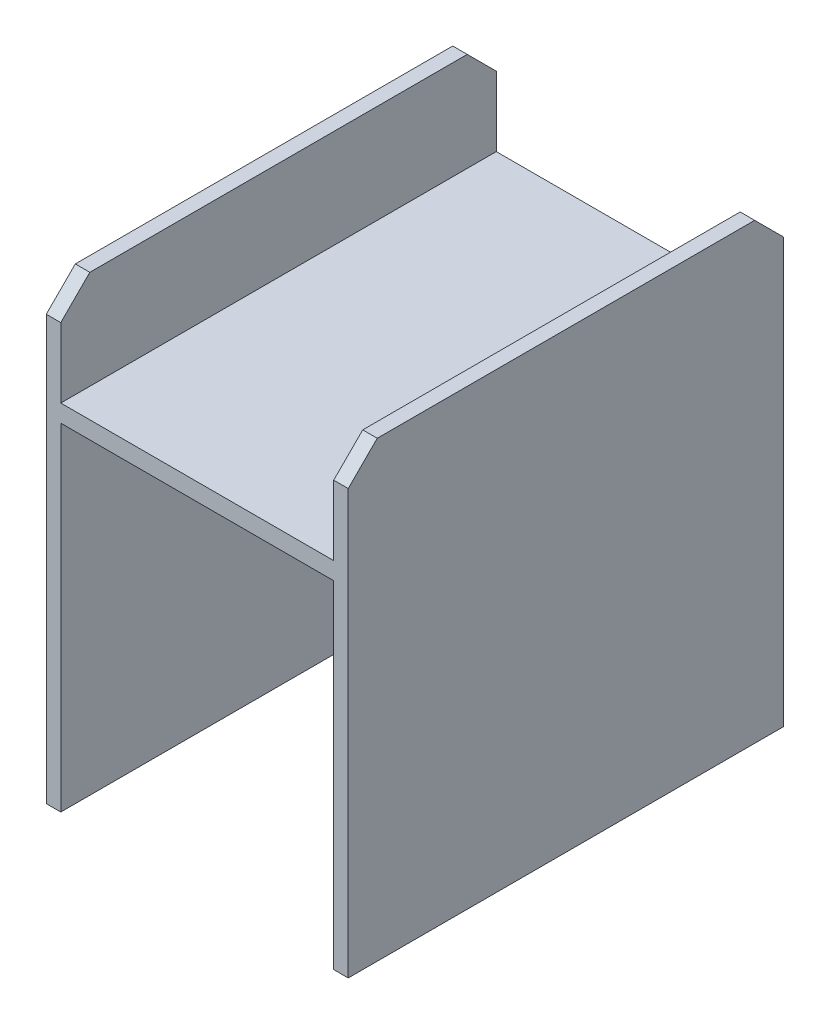
from build123d import *

# Parameters (mm, degrees)
SKETCH1_W                = 52
SKETCH1_H                = 75
BOSS_EXTRUDE1_DEPTH      = 3
BOSS_EXTRUDE2_DEPTH      = 38
BOSS_EXTRUDE2_DEPTH_BACK = 40
SKETCH2_W                = 2.5
SKETCH2_H                = 75
SKETCH5_W                = 75
SKETCH5_H                = 3
BOSS_EXTRUDE5_DEPTH      = 47
CUT_EXTRUDE1_DEPTH       = 92.643201899
CUT_EXTRUDE1_DEPTH_BACK  = 92.643201899
SKETCH6_W                = 47
SKETCH6_H                = 3
CHAMFER1_SIZE            = 5


with BuildPart() as part:
    # Sketch1 → Boss-Extrude1 (new body)
    with BuildSketch(Plane(origin=(0, 0, 0), x_dir=(1, 0, 0), z_dir=(0, 1, 0))):
        with Locations((-7.052631579, -5.043859649)):
            Rectangle(SKETCH1_W, SKETCH1_H)
    extrude(amount=BOSS_EXTRUDE1_DEPTH)

    # Sketch2 → Boss-Extrude2 (add, two sides: drawn at the far end of the back side and taken through both)
    with BuildSketch(Plane(origin=(0, 3, 0), x_dir=(1, 0, 0), z_dir=(0, 1, 0)).offset(-BOSS_EXTRUDE2_DEPTH_BACK)):
        with Locations((-31.802631579, -5.043859649)):
            Rectangle(SKETCH2_W, SKETCH2_H)
        with Locations((17.697368421, -5.043859649)):
            Rectangle(SKETCH2_W, SKETCH2_H)
    extrude(amount=BOSS_EXTRUDE2_DEPTH + BOSS_EXTRUDE2_DEPTH_BACK)

    # Sketch5 → Boss-Extrude5 (add)
    with BuildSketch(Plane(origin=(-30.552631579, 0, 0), x_dir=(0, 0, -1), z_dir=(1, 0, 0))):
        with Locations((-5.043859649, 22.5)):
            Rectangle(SKETCH5_W, SKETCH5_H)
    extrude(amount=BOSS_EXTRUDE5_DEPTH)

    # Sketch6 → Cut-Extrude1 (cut, two sides: drawn at the far end of the back side and taken through both)
    with BuildSketch(Plane.XY.offset(42.543859649).offset(-CUT_EXTRUDE1_DEPTH_BACK)):
        with Locations((-7.052631579, 1.5)):
            Rectangle(SKETCH6_W, SKETCH6_H)
    extrude(amount=CUT_EXTRUDE1_DEPTH + CUT_EXTRUDE1_DEPTH_BACK, mode=Mode.SUBTRACT)

    # Chamfer1
    chamfer1_edges = [part.edges().sort_by_distance(p)[0] for p in [
        (-31.802631579, 41, 42.543859649),
        (-31.802631579, 41, -32.456140351),
        (17.697368421, 41, -32.456140351),
        (17.697368421, 41, 42.543859649),
    ]]
    chamfer(chamfer1_edges, length=CHAMFER1_SIZE)


solid = part.part
